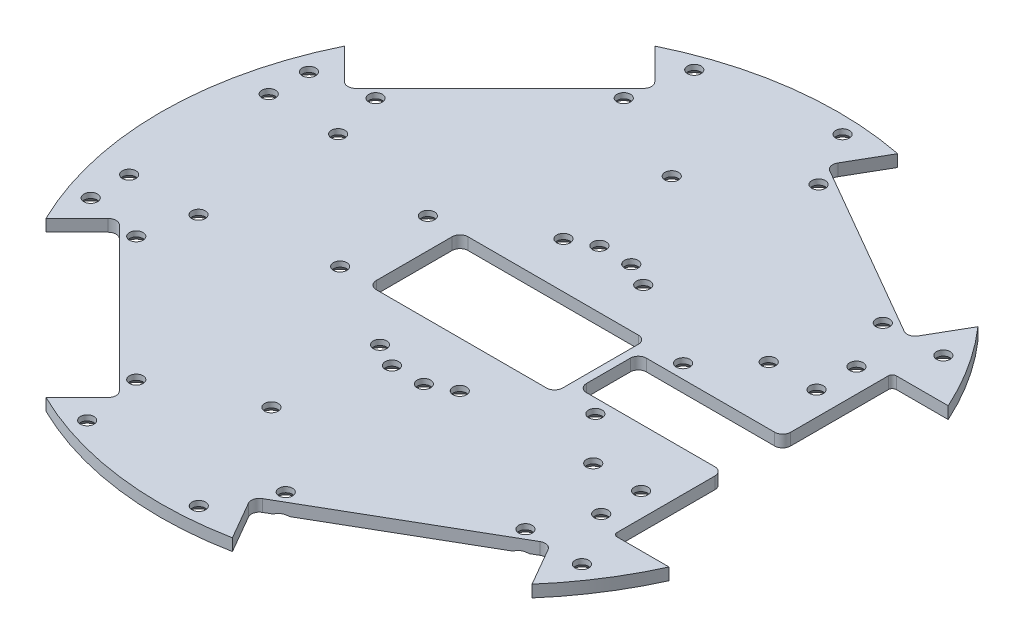
from build123d import *

# Parameters (mm, degrees)
ESBO_O1_R                            = 1.7
ESBO_O1_R_2                          = 1.5
BASE_DEPTH                           = 3
ESBO_O21_R                           = 1.5
BOCA_CHUTE_DEPTH                     = 20
ESBO_O32_W                           = 15
ESBO_O32_H                           = 3
CORTE_EXTRUS_O2_DEPTH                = 36.19
ESBO_O33_W                           = 46.7
ESBO_O33_H                           = 23
CORTE_EXTRUS_O3_DEPTH                = 121.245582039
ESCAREADO_PARA_SFHCS_M31_AT_2_COUNT  = 2
ESCAREADO_PARA_SFHCS_M31_AT_2_PITCH  = 15.778807994
ESCAREADO_PARA_SFHCS_M31_AT_3_COUNT  = 2
ESCAREADO_PARA_SFHCS_M31_AT_3_PITCH  = 24.803644103
ESCAREADO_PARA_SFHCS_M31_AT_4_COUNT  = 2
ESCAREADO_PARA_SFHCS_M31_AT_4_PITCH  = 14.672333655
ESCAREADO_PARA_SFHCS_M31_AT_5_COUNT  = 2
ESCAREADO_PARA_SFHCS_M31_AT_5_PITCH  = 31.024361988
ESCAREADO_PARA_SFHCS_M31_AT_6_COUNT  = 2
ESCAREADO_PARA_SFHCS_M31_AT_6_PITCH  = 46.195436644
ESCAREADO_PARA_SFHCS_M31_AT_7_COUNT  = 2
ESCAREADO_PARA_SFHCS_M31_AT_7_PITCH  = 56.974340684
ESCAREADO_PARA_SFHCS_M31_AT_8_COUNT  = 2
ESCAREADO_PARA_SFHCS_M31_AT_8_PITCH  = 70.231725656
ESCAREADO_PARA_SFHCS_M31_AT_9_COUNT  = 2
ESCAREADO_PARA_SFHCS_M31_AT_9_PITCH  = 73.1355501
ESCAREADO_PARA_SFHCS_M31_AT_10_COUNT = 2
ESCAREADO_PARA_SFHCS_M31_AT_10_PITCH = 69.660679329
ESCAREADO_PARA_SFHCS_M31_AT_11_COUNT = 2
ESCAREADO_PARA_SFHCS_M31_AT_11_PITCH = 62.013939749
ESCAREADO_PARA_SFHCS_M31_AT_12_COUNT = 2
ESCAREADO_PARA_SFHCS_M31_AT_12_PITCH = 57.440774505
ESCAREADO_PARA_SFHCS_M31_AT_13_COUNT = 2
ESCAREADO_PARA_SFHCS_M31_AT_13_PITCH = 76.266941589
ESCAREADO_PARA_SFHCS_M31_AT_14_COUNT = 2
ESCAREADO_PARA_SFHCS_M31_AT_14_PITCH = 98.201353291
ESCAREADO_PARA_SFHCS_M31_AT_15_COUNT = 2
ESCAREADO_PARA_SFHCS_M31_AT_15_PITCH = 97.224310032
ESCAREADO_PARA_SFHCS_M31_AT_16_COUNT = 2
ESCAREADO_PARA_SFHCS_M31_AT_16_PITCH = 100.940925983
ESCAREADO_PARA_SFHCS_M31_AT_17_COUNT = 2
ESCAREADO_PARA_SFHCS_M31_AT_17_PITCH = 127.963592519
ESCAREADO_PARA_SFHCS_M31_AT_18_COUNT = 2
ESCAREADO_PARA_SFHCS_M31_AT_18_PITCH = 127.012611842
ESCAREADO_PARA_SFHCS_M31_AT_19_COUNT = 2
ESCAREADO_PARA_SFHCS_M31_AT_19_PITCH = 144.039245847
ESCAREADO_PARA_SFHCS_M31_AT_20_COUNT = 2
ESCAREADO_PARA_SFHCS_M31_AT_20_PITCH = 142.242742638
ESCAREADO_PARA_SFHCS_M31_AT_21_COUNT = 2
ESCAREADO_PARA_SFHCS_M31_AT_21_PITCH = 64.247710626
ESCAREADO_PARA_SFHCS_M31_AT_22_COUNT = 2
ESCAREADO_PARA_SFHCS_M31_AT_22_PITCH = 70.356314178
ESCAREADO_PARA_SFHCS_M31_AT_23_COUNT = 2
ESCAREADO_PARA_SFHCS_M31_AT_23_PITCH = 67.843353902
ESCAREADO_PARA_SFHCS_M31_AT_24_COUNT = 2
ESCAREADO_PARA_SFHCS_M31_AT_24_PITCH = 77.775128723
ESCAREADO_PARA_SFHCS_M31_AT_25_COUNT = 2
ESCAREADO_PARA_SFHCS_M31_AT_25_PITCH = 90.624997908
ESCAREADO_PARA_SFHCS_M31_AT_26_COUNT = 2
ESCAREADO_PARA_SFHCS_M31_AT_26_PITCH = 91.294515218
ESCAREADO_PARA_SFHCS_M31_AT_27_COUNT = 2
ESCAREADO_PARA_SFHCS_M31_AT_27_PITCH = 123.907169035
ESCAREADO_PARA_SFHCS_M31_AT_28_COUNT = 2
ESCAREADO_PARA_SFHCS_M31_AT_28_PITCH = 139.858476117
ESCAREADO_PARA_SFHCS_M31_AT_29_COUNT = 2
ESCAREADO_PARA_SFHCS_M31_AT_29_PITCH = 120.187694721
ESCAREADO_PARA_SFHCS_M31_AT_30_COUNT = 2
ESCAREADO_PARA_SFHCS_M31_AT_30_PITCH = 86.418704454
ESCAREADO_PARA_SFHCS_M31_AT_31_COUNT = 2
ESCAREADO_PARA_SFHCS_M31_AT_31_PITCH = 92.510694594
ESCAREADO_PARA_SFHCS_M31_AT_32_COUNT = 2
ESCAREADO_PARA_SFHCS_M31_AT_32_PITCH = 97.801381053
ESCAREADO_PARA_SFHCS_M31_AT_33_COUNT = 2
ESCAREADO_PARA_SFHCS_M31_AT_33_PITCH = 99.926954738
ESCAREADO_PARA_SFHCS_M31_AT_34_COUNT = 2
ESCAREADO_PARA_SFHCS_M31_AT_34_PITCH = 143.281248378
ESCAREADO_PARA_SFHCS_M31_AT_35_COUNT = 2
ESCAREADO_PARA_SFHCS_M31_AT_35_PITCH = 153.095014926
ESCAREADO_PARA_SFHCS_M31_AT_36_COUNT = 2
ESCAREADO_PARA_SFHCS_M31_AT_36_PITCH = 110.375814797
ESCAREADO_PARA_SFHCS_M31_AT_37_COUNT = 2
ESCAREADO_PARA_SFHCS_M31_AT_37_PITCH = 138.939117939
ESCAREADO_PARA_SFHCS_M31_AT_38_COUNT = 2
ESCAREADO_PARA_SFHCS_M31_AT_38_PITCH = 154.658266093
ESCAREADO_PARA_SFHCS_M31_AT_39_COUNT = 2
ESCAREADO_PARA_SFHCS_M31_AT_39_PITCH = 158.720791949
ESCAREADO_PARA_SFHCS_M31_AT_40_COUNT = 2
ESCAREADO_PARA_SFHCS_M31_AT_40_PITCH = 147.690399946
FILETE1_R                            = 2
FILETE2_R                            = 1


with BuildPart() as part:
    # Esboço1 → Base (new body)
    with BuildSketch(Plane(origin=(0, 0, 0), x_dir=(1, 0, 0), z_dir=(0, 1, 0))):
        with BuildLine():
            Line((-67.124614158, -28.233741192), (-28.233741192, -67.124614158))
            Line((-28.233741192, -67.124614158), (-37.426129348, -76.317002313))
            ThreePointArc((-37.426129348, -76.317002313), (-11.094726339, -84.272813217), (16.398571251, -83.403158579))
            Line((16.398571251, -83.403158579), (9.898571251, -72.14482833))
            Line((9.898571251, -72.14482833), (57.529968459, -44.64482833))
            Line((57.529968459, -44.64482833), (64.029968459, -55.903158579))
            ThreePointArc((64.029968459, -55.903158579), (85, 0), (64.029968459, 55.903158579))
            Line((64.029968459, 55.903158579), (57.529968459, 44.64482833))
            Line((57.529968459, 44.64482833), (9.898571251, 72.14482833))
            Line((9.898571251, 72.14482833), (16.398571251, 83.403158579))
            ThreePointArc((16.398571251, 83.403158579), (-11.094726339, 84.272813217), (-37.426129348, 76.317002313))
            Line((-37.426129348, 76.317002313), (-28.233741192, 67.124614158))
            Line((-28.233741192, 67.124614158), (-67.124614158, 28.233741192))
            Line((-67.124614158, 28.233741192), (-76.317002313, 37.426129348))
            ThreePointArc((-76.317002313, 37.426129348), (-85, 0), (-76.317002313, -37.426129348))
            Line((-76.317002313, -37.426129348), (-67.124614158, -28.233741192))
        make_face()
        with Locations(Location((-61.114206518, -30.001508145, 0), (0, 0, 270))):
            Circle(ESBO_O1_R, mode=Mode.SUBTRACT)
        with Locations(Location((-30.001508145, -61.114206518, 0), (0, 0, 90))):
            Circle(ESBO_O1_R, mode=Mode.SUBTRACT)
        with Locations(Location((13.161710972, -66.796752118, 0), (0, 0, 270))):
            Circle(ESBO_O1_R, mode=Mode.SUBTRACT)
        with Locations(Location((51.266828739, -44.796752118, 0), (0, 0, 90))):
            Circle(ESBO_O1_R, mode=Mode.SUBTRACT)
        with Locations(Location((-61.114206518, 30.001508145, 0), (0, 0, 90))):
            Circle(ESBO_O1_R, mode=Mode.SUBTRACT)
        with Locations(Location((-30.001508145, 61.114206518, 0), (0, 0, 270))):
            Circle(ESBO_O1_R, mode=Mode.SUBTRACT)
        with Locations(Location((13.161710972, 66.796752118, 0), (0, 0, 90))):
            Circle(ESBO_O1_R, mode=Mode.SUBTRACT)
        with Locations(Location((51.266828739, 44.796752118, 0), (0, 0, 270))):
            Circle(ESBO_O1_R, mode=Mode.SUBTRACT)
        with Locations(Location((-75.398491, 17.5, 0), (0, 0, 270))):
            Circle(ESBO_O1_R_2, mode=Mode.SUBTRACT)
        with Locations(Location((-58, 17.5, 0), (0, 0, 270))):
            Circle(ESBO_O1_R_2, mode=Mode.SUBTRACT)
        with Locations(Location((-58, -17.5, 0), (0, 0, 90))):
            Circle(ESBO_O1_R_2, mode=Mode.SUBTRACT)
        with Locations(Location((-75.398491, -17.5, 0), (0, 0, 90))):
            Circle(ESBO_O1_R_2, mode=Mode.SUBTRACT)
        with Locations(Location((-27.317649341, 76.108017243, 0), (0, 0, 270))):
            Circle(ESBO_O1_R_2, mode=Mode.SUBTRACT)
        with Locations(Location((-75.175409663, 27.361611466, 0), (0, 0, 270))):
            Circle(ESBO_O1_R_2, mode=Mode.SUBTRACT)
        with Locations(Location((65.93009509, 45.312498954, 0), (0, 0, 270))):
            Circle(ESBO_O1_R_2, mode=Mode.SUBTRACT)
        with Locations(Location((65.93009509, -45.312498954, 0), (0, 0, 90))):
            Circle(ESBO_O1_R_2, mode=Mode.SUBTRACT)
        with Locations(Location((-75.175409663, -27.361611466, 0), (0, 0, 90))):
            Circle(ESBO_O1_R_2, mode=Mode.SUBTRACT)
        with Locations(Location((7, -26, 0), (0, 0, 270))):
            Circle(ESBO_O1_R_2, mode=Mode.SUBTRACT)
        with Locations(Location((13, -23, 0), (0, 0, 270))):
            Circle(ESBO_O1_R_2, mode=Mode.SUBTRACT)
        with Locations(Location((35, -11, 0), (0, 0, 270))):
            Circle(ESBO_O1_R_2, mode=Mode.SUBTRACT)
        with Locations(Location((5.268571782, 80.705646294, 0), (0, 0, 270))):
            Circle(ESBO_O1_R_2, mode=Mode.SUBTRACT)
        with Locations(Location((-7.042875224, 50.186336462, 0), (0, 0, 270))):
            Circle(ESBO_O1_R_2, mode=Mode.SUBTRACT)
        with Locations(Location((-27.317649341, -76.108017243, 0), (0, 0, 90))):
            Circle(ESBO_O1_R_2, mode=Mode.SUBTRACT)
        with Locations(Location((5.268571782, -80.705646294, 0), (0, 0, 90))):
            Circle(ESBO_O1_R_2, mode=Mode.SUBTRACT)
        with Locations(Location((-7.042875224, -50.186336462, 0), (0, 0, 90))):
            Circle(ESBO_O1_R_2, mode=Mode.SUBTRACT)
        with Locations(Location((-29, -11, 0), (0, 0, 90))):
            Circle(ESBO_O1_R_2, mode=Mode.SUBTRACT)
        with Locations(Location((-7, -23, 0), (0, 0, 90))):
            Circle(ESBO_O1_R_2, mode=Mode.SUBTRACT)
        with Locations(Location((-1, -26, 0), (0, 0, 90))):
            Circle(ESBO_O1_R_2, mode=Mode.SUBTRACT)
        with Locations(Location((35, 11, 0), (0, 0, 90))):
            Circle(ESBO_O1_R_2, mode=Mode.SUBTRACT)
        with Locations(Location((13, 23, 0), (0, 0, 90))):
            Circle(ESBO_O1_R_2, mode=Mode.SUBTRACT)
        with Locations(Location((7, 26, 0), (0, 0, 90))):
            Circle(ESBO_O1_R_2, mode=Mode.SUBTRACT)
        with Locations(Location((-1, 26, 0), (0, 0, 270))):
            Circle(ESBO_O1_R_2, mode=Mode.SUBTRACT)
        with Locations(Location((-7, 23, 0), (0, 0, 270))):
            Circle(ESBO_O1_R_2, mode=Mode.SUBTRACT)
        with Locations(Location((-29, 11, 0), (0, 0, 270))):
            Circle(ESBO_O1_R_2, mode=Mode.SUBTRACT)
    extrude(amount=BASE_DEPTH)

    # Esboço21 → Boca Chute (cut)
    with BuildSketch(Plane.XZ):
        with Locations(Location((57.459666924, 32, 0), (0, 0, 270))):
            Circle(ESBO_O21_R)
        with Locations(Location((57.459666924, 22, 0), (0, 0, 270))):
            Circle(ESBO_O21_R)
        with Locations(Location((45.459666924, 22, 0), (0, 0, 270))):
            Circle(ESBO_O21_R)
        with Locations(Location((45.459666924, -22, 0), (0, 0, 90))):
            Circle(ESBO_O21_R)
        with Locations(Location((57.459666924, -22, 0), (0, 0, 90))):
            Circle(ESBO_O21_R)
        with Locations(Location((57.459666924, -32, 0), (0, 0, 90))):
            Circle(ESBO_O21_R)
        with BuildLine():
            Line((63.459666924, -35), (77.459666924, -35))
            ThreePointArc((77.459666924, -35), (85, 0), (77.459666924, 35))
            Line((77.459666924, 35), (63.459666924, 35))
            Line((63.459666924, 35), (63.459666924, -35))
        make_face()
    extrude(amount=-BOCA_CHUTE_DEPTH, mode=Mode.SUBTRACT)

    # Esboço32 → Corte-extrusão2 (cut)
    with BuildSketch(Plane(origin=(63.459666924, 0, 0), x_dir=(0, 0, -1), z_dir=(1, 0, 0))):
        with Locations((0, 1.5)):
            Rectangle(ESBO_O32_W, ESBO_O32_H)
    extrude(amount=-CORTE_EXTRUS_O2_DEPTH, mode=Mode.SUBTRACT)

    # Esboço33 → Corte-extrusão3 (cut, through all)
    with BuildSketch(Plane(origin=(0, 3, 0), x_dir=(1, 0, 0), z_dir=(0, 1, 0))):
        with Locations((1.919666924, 0)):
            Rectangle(ESBO_O33_W, ESBO_O33_H)
    extrude(amount=-CORTE_EXTRUS_O3_DEPTH, mode=Mode.SUBTRACT)

    # Esboço35 → Escareado para SFHCS M31 (revolve, cut)
    with BuildSketch(Plane(origin=(65.93009509, 0, -45.312498954), x_dir=(0, 0, -1), z_dir=(1, 0, 0))):
        Polygon((0, 0), (0, 3), (1.7, 3), (1.7, 1.66), (3.36, 0), align=None)
    escareado_para_sfhcs_m31 = revolve(axis=Axis((65.93009509, -6.35, -45.312498954), (0, 1, 0)), mode=Mode.SUBTRACT)

    # Escareado para SFHCS M31 at 2: Escareado para SFHCS M31 ×2
    with Locations(*[Vector(-0.5368230711015738, 0, 0.8436948443205485) * (i * ESCAREADO_PARA_SFHCS_M31_AT_2_PITCH) for i in range(1, ESCAREADO_PARA_SFHCS_M31_AT_2_COUNT)]):
        add(escareado_para_sfhcs_m31, mode=Mode.SUBTRACT)

    # Escareado para SFHCS M31 at 3: Escareado para SFHCS M31 ×2
    with Locations(*[Vector(-0.3414993430174129, 0, 0.9398820131903128) * (i * ESCAREADO_PARA_SFHCS_M31_AT_3_PITCH) for i in range(1, ESCAREADO_PARA_SFHCS_M31_AT_3_COUNT)]):
        add(escareado_para_sfhcs_m31, mode=Mode.SUBTRACT)

    # Escareado para SFHCS M31 at 4: Escareado para SFHCS M31 ×2
    with Locations(*[Vector(-0.9993820135192064, 0, 0.03515097515427815) * (i * ESCAREADO_PARA_SFHCS_M31_AT_4_PITCH) for i in range(1, ESCAREADO_PARA_SFHCS_M31_AT_4_COUNT)]):
        add(escareado_para_sfhcs_m31, mode=Mode.SUBTRACT)

    # Escareado para SFHCS M31 at 5: Escareado para SFHCS M31 ×2
    with Locations(*[Vector(-0.6598178609933625, 0, 0.7514255720390035) * (i * ESCAREADO_PARA_SFHCS_M31_AT_5_PITCH) for i in range(1, ESCAREADO_PARA_SFHCS_M31_AT_5_COUNT)]):
        add(escareado_para_sfhcs_m31, mode=Mode.SUBTRACT)

    # Escareado para SFHCS M31 at 6: Escareado para SFHCS M31 ×2
    with Locations(*[Vector(-0.6695487116644616, 0, 0.7427681486900605) * (i * ESCAREADO_PARA_SFHCS_M31_AT_6_PITCH) for i in range(1, ESCAREADO_PARA_SFHCS_M31_AT_6_COUNT)]):
        add(escareado_para_sfhcs_m31, mode=Mode.SUBTRACT)

    # Escareado para SFHCS M31 at 7: Escareado para SFHCS M31 ×2
    with Locations(*[Vector(-0.9261780563644781, 0, -0.3770864727206712) * (i * ESCAREADO_PARA_SFHCS_M31_AT_7_PITCH) for i in range(1, ESCAREADO_PARA_SFHCS_M31_AT_7_COUNT)]):
        add(escareado_para_sfhcs_m31, mode=Mode.SUBTRACT)

    # Escareado para SFHCS M31 at 8: Escareado para SFHCS M31 ×2
    with Locations(*[Vector(-0.8637339142787613, 0, -0.5039481375346966) * (i * ESCAREADO_PARA_SFHCS_M31_AT_8_PITCH) for i in range(1, ESCAREADO_PARA_SFHCS_M31_AT_8_COUNT)]):
        add(escareado_para_sfhcs_m31, mode=Mode.SUBTRACT)

    # Escareado para SFHCS M31 at 9: Escareado para SFHCS M31 ×2
    with Locations(*[Vector(-0.9977770074019141, 0, -0.06664115470248576) * (i * ESCAREADO_PARA_SFHCS_M31_AT_9_PITCH) for i in range(1, ESCAREADO_PARA_SFHCS_M31_AT_9_COUNT)]):
        add(escareado_para_sfhcs_m31, mode=Mode.SUBTRACT)

    # Escareado para SFHCS M31 at 10: Escareado para SFHCS M31 ×2
    with Locations(*[Vector(-0.9608016421099759, 0, 0.27723673010402866) * (i * ESCAREADO_PARA_SFHCS_M31_AT_10_PITCH) for i in range(1, ESCAREADO_PARA_SFHCS_M31_AT_10_COUNT)]):
        add(escareado_para_sfhcs_m31, mode=Mode.SUBTRACT)

    # Escareado para SFHCS M31 at 11: Escareado para SFHCS M31 ×2
    with Locations(*[Vector(-0.9502717506533689, 0, 0.31142190017752686) * (i * ESCAREADO_PARA_SFHCS_M31_AT_11_PITCH) for i in range(1, ESCAREADO_PARA_SFHCS_M31_AT_11_COUNT)]):
        add(escareado_para_sfhcs_m31, mode=Mode.SUBTRACT)

    # Escareado para SFHCS M31 at 12: Escareado para SFHCS M31 ×2
    with Locations(*[Vector(-0.9214725174843268, 0, 0.38844356027754806) * (i * ESCAREADO_PARA_SFHCS_M31_AT_12_PITCH) for i in range(1, ESCAREADO_PARA_SFHCS_M31_AT_12_COUNT)]):
        add(escareado_para_sfhcs_m31, mode=Mode.SUBTRACT)

    # Escareado para SFHCS M31 at 13: Escareado para SFHCS M31 ×2
    with Locations(*[Vector(-0.9562477997684796, 0, 0.29255793518197687) * (i * ESCAREADO_PARA_SFHCS_M31_AT_13_PITCH) for i in range(1, ESCAREADO_PARA_SFHCS_M31_AT_13_COUNT)]):
        add(escareado_para_sfhcs_m31, mode=Mode.SUBTRACT)

    # Escareado para SFHCS M31 at 14: Escareado para SFHCS M31 ×2
    with Locations(*[Vector(-0.9495566130819911, 0, -0.31359566092702545) * (i * ESCAREADO_PARA_SFHCS_M31_AT_14_PITCH) for i in range(1, ESCAREADO_PARA_SFHCS_M31_AT_14_COUNT)]):
        add(escareado_para_sfhcs_m31, mode=Mode.SUBTRACT)

    # Escareado para SFHCS M31 at 15: Escareado para SFHCS M31 ×2
    with Locations(*[Vector(-0.9867038727620702, 0, -0.1625283589910772) * (i * ESCAREADO_PARA_SFHCS_M31_AT_15_PITCH) for i in range(1, ESCAREADO_PARA_SFHCS_M31_AT_15_COUNT)]):
        add(escareado_para_sfhcs_m31, mode=Mode.SUBTRACT)

    # Escareado para SFHCS M31 at 16: Escareado para SFHCS M31 ×2
    with Locations(*[Vector(-0.9404519937349747, 0, 0.3399265324741673) * (i * ESCAREADO_PARA_SFHCS_M31_AT_16_PITCH) for i in range(1, ESCAREADO_PARA_SFHCS_M31_AT_16_COUNT)]):
        add(escareado_para_sfhcs_m31, mode=Mode.SUBTRACT)

    # Escareado para SFHCS M31 at 17: Escareado para SFHCS M31 ×2
    with Locations(*[Vector(-0.9928159963795692, 0, 0.11965114848108752) * (i * ESCAREADO_PARA_SFHCS_M31_AT_17_PITCH) for i in range(1, ESCAREADO_PARA_SFHCS_M31_AT_17_COUNT)]):
        add(escareado_para_sfhcs_m31, mode=Mode.SUBTRACT)

    # Escareado para SFHCS M31 at 18: Escareado para SFHCS M31 ×2
    with Locations(*[Vector(-0.9757306246371599, 0, 0.21897430932686604) * (i * ESCAREADO_PARA_SFHCS_M31_AT_18_PITCH) for i in range(1, ESCAREADO_PARA_SFHCS_M31_AT_18_COUNT)]):
        add(escareado_para_sfhcs_m31, mode=Mode.SUBTRACT)

    # Escareado para SFHCS M31 at 19: Escareado para SFHCS M31 ×2
    with Locations(*[Vector(-0.9811811028211027, 0, 0.1930897290555995) * (i * ESCAREADO_PARA_SFHCS_M31_AT_19_PITCH) for i in range(1, ESCAREADO_PARA_SFHCS_M31_AT_19_COUNT)]):
        add(escareado_para_sfhcs_m31, mode=Mode.SUBTRACT)

    # Escareado para SFHCS M31 at 20: Escareado para SFHCS M31 ×2
    with Locations(*[Vector(-0.9920049496797154, 0, 0.1261989691358266) * (i * ESCAREADO_PARA_SFHCS_M31_AT_20_PITCH) for i in range(1, ESCAREADO_PARA_SFHCS_M31_AT_20_COUNT)]):
        add(escareado_para_sfhcs_m31, mode=Mode.SUBTRACT)

    # Escareado para SFHCS M31 at 21: Escareado para SFHCS M31 ×2
    with Locations(*[Vector(-0.48141941227648327, 0, 0.8764903590361766) * (i * ESCAREADO_PARA_SFHCS_M31_AT_21_PITCH) for i in range(1, ESCAREADO_PARA_SFHCS_M31_AT_21_COUNT)]):
        add(escareado_para_sfhcs_m31, mode=Mode.SUBTRACT)

    # Escareado para SFHCS M31 at 22: Escareado para SFHCS M31 ×2
    with Locations(*[Vector(-0.29095367494411967, 0, 0.9567371420805778) * (i * ESCAREADO_PARA_SFHCS_M31_AT_22_PITCH) for i in range(1, ESCAREADO_PARA_SFHCS_M31_AT_22_COUNT)]):
        add(escareado_para_sfhcs_m31, mode=Mode.SUBTRACT)

    # Escareado para SFHCS M31 at 23: Escareado para SFHCS M31 ×2
    with Locations(*[Vector(-0.12485273322110378, 0, 0.9921752844166297) * (i * ESCAREADO_PARA_SFHCS_M31_AT_23_PITCH) for i in range(1, ESCAREADO_PARA_SFHCS_M31_AT_23_COUNT)]):
        add(escareado_para_sfhcs_m31, mode=Mode.SUBTRACT)

    # Escareado para SFHCS M31 at 24: Escareado para SFHCS M31 ×2
    with Locations(*[Vector(-0.10890921435595721, 0, 0.9940517003799995) * (i * ESCAREADO_PARA_SFHCS_M31_AT_24_PITCH) for i in range(1, ESCAREADO_PARA_SFHCS_M31_AT_24_COUNT)]):
        add(escareado_para_sfhcs_m31, mode=Mode.SUBTRACT)

    # Escareado para SFHCS M31 at 25: Escareado para SFHCS M31 ×2
    with Locations(*[(0, 0, i * ESCAREADO_PARA_SFHCS_M31_AT_25_PITCH) for i in range(1, ESCAREADO_PARA_SFHCS_M31_AT_25_COUNT)]):
        add(escareado_para_sfhcs_m31, mode=Mode.SUBTRACT)

    # Escareado para SFHCS M31 at 26: Escareado para SFHCS M31 ×2
    with Locations(*[Vector(-0.16061497578618011, 0, 0.9870171374161671) * (i * ESCAREADO_PARA_SFHCS_M31_AT_26_PITCH) for i in range(1, ESCAREADO_PARA_SFHCS_M31_AT_26_COUNT)]):
        add(escareado_para_sfhcs_m31, mode=Mode.SUBTRACT)

    # Escareado para SFHCS M31 at 27: Escareado para SFHCS M31 ×2
    with Locations(*[Vector(-0.4258703070085644, 0, 0.9047842182578292) * (i * ESCAREADO_PARA_SFHCS_M31_AT_27_PITCH) for i in range(1, ESCAREADO_PARA_SFHCS_M31_AT_27_COUNT)]):
        add(escareado_para_sfhcs_m31, mode=Mode.SUBTRACT)

    # Escareado para SFHCS M31 at 28: Escareado para SFHCS M31 ×2
    with Locations(*[Vector(-0.4337350512585161, 0, 0.9010404570882334) * (i * ESCAREADO_PARA_SFHCS_M31_AT_28_PITCH) for i in range(1, ESCAREADO_PARA_SFHCS_M31_AT_28_COUNT)]):
        add(escareado_para_sfhcs_m31, mode=Mode.SUBTRACT)

    # Escareado para SFHCS M31 at 29: Escareado para SFHCS M31 ×2
    with Locations(*[Vector(-0.6071584157043852, 0, 0.7945808066139913) * (i * ESCAREADO_PARA_SFHCS_M31_AT_29_PITCH) for i in range(1, ESCAREADO_PARA_SFHCS_M31_AT_29_COUNT)]):
        add(escareado_para_sfhcs_m31, mode=Mode.SUBTRACT)

    # Escareado para SFHCS M31 at 30: Escareado para SFHCS M31 ×2
    with Locations(*[Vector(-0.6124842465995052, 0, 0.7904827940363007) * (i * ESCAREADO_PARA_SFHCS_M31_AT_30_PITCH) for i in range(1, ESCAREADO_PARA_SFHCS_M31_AT_30_COUNT)]):
        add(escareado_para_sfhcs_m31, mode=Mode.SUBTRACT)

    # Escareado para SFHCS M31 at 31: Escareado para SFHCS M31 ×2
    with Locations(*[Vector(-0.6370084599201192, 0, 0.7708568103027941) * (i * ESCAREADO_PARA_SFHCS_M31_AT_31_PITCH) for i in range(1, ESCAREADO_PARA_SFHCS_M31_AT_31_COUNT)]):
        add(escareado_para_sfhcs_m31, mode=Mode.SUBTRACT)

    # Escareado para SFHCS M31 at 32: Escareado para SFHCS M31 ×2
    with Locations(*[Vector(-0.684347136711664, 0, 0.7291563594144587) * (i * ESCAREADO_PARA_SFHCS_M31_AT_32_PITCH) for i in range(1, ESCAREADO_PARA_SFHCS_M31_AT_32_COUNT)]):
        add(escareado_para_sfhcs_m31, mode=Mode.SUBTRACT)

    # Escareado para SFHCS M31 at 33: Escareado para SFHCS M31 ×2
    with Locations(*[Vector(-0.7298340601015477, 0, 0.6836243447359746) * (i * ESCAREADO_PARA_SFHCS_M31_AT_33_PITCH) for i in range(1, ESCAREADO_PARA_SFHCS_M31_AT_33_COUNT)]):
        add(escareado_para_sfhcs_m31, mode=Mode.SUBTRACT)

    # Escareado para SFHCS M31 at 34: Escareado para SFHCS M31 ×2
    with Locations(*[Vector(-0.6695335525131776, 0, 0.7427818132258518) * (i * ESCAREADO_PARA_SFHCS_M31_AT_34_PITCH) for i in range(1, ESCAREADO_PARA_SFHCS_M31_AT_34_COUNT)]):
        add(escareado_para_sfhcs_m31, mode=Mode.SUBTRACT)

    # Escareado para SFHCS M31 at 35: Escareado para SFHCS M31 ×2
    with Locations(*[Vector(-0.609084132990178, 0, 0.7931056165099344) * (i * ESCAREADO_PARA_SFHCS_M31_AT_35_PITCH) for i in range(1, ESCAREADO_PARA_SFHCS_M31_AT_35_COUNT)]):
        add(escareado_para_sfhcs_m31, mode=Mode.SUBTRACT)

    # Escareado para SFHCS M31 at 36: Escareado para SFHCS M31 ×2
    with Locations(*[Vector(-0.8600624626327324, 0, 0.5101887497486786) * (i * ESCAREADO_PARA_SFHCS_M31_AT_36_PITCH) for i in range(1, ESCAREADO_PARA_SFHCS_M31_AT_36_COUNT)]):
        add(escareado_para_sfhcs_m31, mode=Mode.SUBTRACT)

    # Escareado para SFHCS M31 at 37: Escareado para SFHCS M31 ×2
    with Locations(*[Vector(-0.8919741029573844, 0, 0.45208649576532295) * (i * ESCAREADO_PARA_SFHCS_M31_AT_37_PITCH) for i in range(1, ESCAREADO_PARA_SFHCS_M31_AT_37_COUNT)]):
        add(escareado_para_sfhcs_m31, mode=Mode.SUBTRACT)

    # Escareado para SFHCS M31 at 38: Escareado para SFHCS M31 ×2
    with Locations(*[Vector(-0.9138120428980717, 0, 0.40613735392654143) * (i * ESCAREADO_PARA_SFHCS_M31_AT_38_PITCH) for i in range(1, ESCAREADO_PARA_SFHCS_M31_AT_38_COUNT)]):
        add(escareado_para_sfhcs_m31, mode=Mode.SUBTRACT)

    # Escareado para SFHCS M31 at 39: Escareado para SFHCS M31 ×2
    with Locations(*[Vector(-0.8890171414857376, 0, 0.4578739151169545) * (i * ESCAREADO_PARA_SFHCS_M31_AT_39_PITCH) for i in range(1, ESCAREADO_PARA_SFHCS_M31_AT_39_COUNT)]):
        add(escareado_para_sfhcs_m31, mode=Mode.SUBTRACT)

    # Escareado para SFHCS M31 at 40: Escareado para SFHCS M31 ×2
    with Locations(*[Vector(-0.8602069034525015, 0, 0.5099451767128099) * (i * ESCAREADO_PARA_SFHCS_M31_AT_40_PITCH) for i in range(1, ESCAREADO_PARA_SFHCS_M31_AT_40_COUNT)]):
        add(escareado_para_sfhcs_m31, mode=Mode.SUBTRACT)

    # Filete1
    filete1_edges = [part.edges().sort_by_distance(p)[0] for p in [
        (27.269666924, 1.5, -7.5),
        (27.269666924, 1.5, 7.5),
        (63.459666924, 1.5, -7.5),
        (63.459666924, 1.5, 7.5),
        (25.269666924, 1.5, -11.5),
        (25.269666924, 1.5, 11.5),
        (-21.430333076, 1.5, 11.5),
        (-21.430333076, 1.5, -11.5),
        (9.898571251, 1.5, -72.14482833),
        (57.529968459, 1.5, -44.64482833),
        (57.529968459, 1.5, 44.64482833),
        (9.898571251, 1.5, 72.14482833),
        (-28.233741192, 1.5, 67.124614158),
        (-67.124614158, 1.5, 28.233741192),
        (-67.124614158, 1.5, -28.233741192),
        (-28.233741192, 1.5, -67.124614158),
    ]]
    fillet(filete1_edges, radius=FILETE1_R)

    # Filete2
    filete2_edges = [part.edges().sort_by_distance(p)[0] for p in [
        (63.459666924, 1.5, -35),
        (63.459666924, 1.5, 35),
    ]]
    fillet(filete2_edges, radius=FILETE2_R)


solid = part.part
